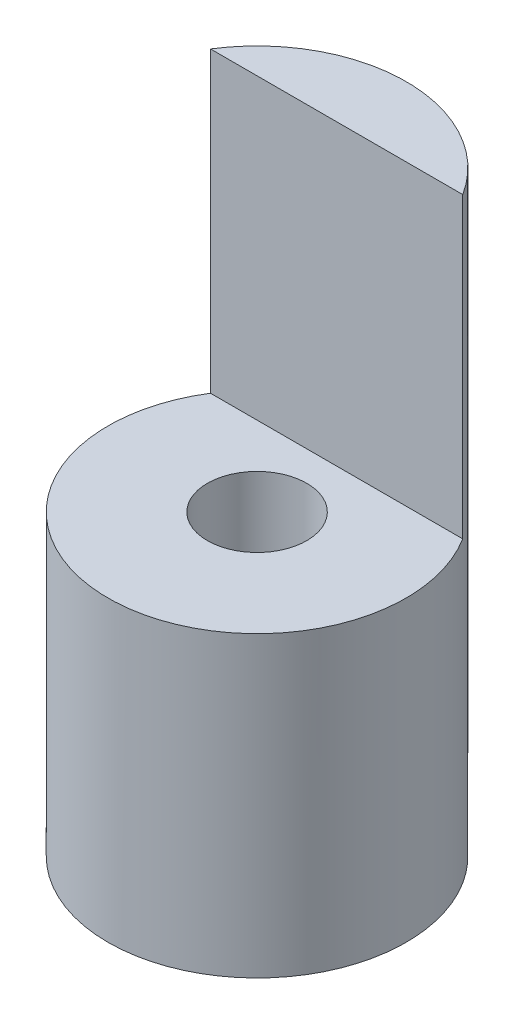
from build123d import *

# Parameters (mm, degrees)
CROQUIS1_R              = 7.5
SALIENTE_EXTRUIR1_DEPTH = 15
CROQUIS3_R              = 2.5
CORTAR_EXTRUIR2_DEPTH   = 32.819805153
CORTAR_EXTRUIR1_DEPTH   = 15


with BuildPart() as part:
    # Croquis1 → Saliente-Extruir1 (new, symmetric)
    with BuildSketch(Plane(origin=(0, 0, 0), x_dir=(1, 0, 0), z_dir=(0, 1, 0))):
        with Locations(Location((0, 0, 0), (0, 0, 270))):
            Circle(CROQUIS1_R)
    extrude(amount=SALIENTE_EXTRUIR1_DEPTH, both=True)

    # Croquis3 → Cortar-Extruir2 (cut, through all)
    with BuildSketch(Plane(origin=(0, 15, 0), x_dir=(1, 0, 0), z_dir=(0, 1, 0))):
        with Locations(Location((0, 0, 0), (0, 0, 270))):
            Circle(CROQUIS3_R)
    extrude(amount=-CORTAR_EXTRUIR2_DEPTH, mode=Mode.SUBTRACT)

    # Croquis2 → Cortar-Extruir1 (cut)
    with BuildSketch(Plane(origin=(0, 15, 0), x_dir=(1, 0, 0), z_dir=(0, 1, 0))):
        with BuildLine():
            Line((-6.34428877, 4), (6.34428877, 4))
            ThreePointArc((6.34428877, 4), (0, -7.5), (-6.34428877, 4))
        make_face()
    extrude(amount=-CORTAR_EXTRUIR1_DEPTH, mode=Mode.SUBTRACT)


solid = part.part
